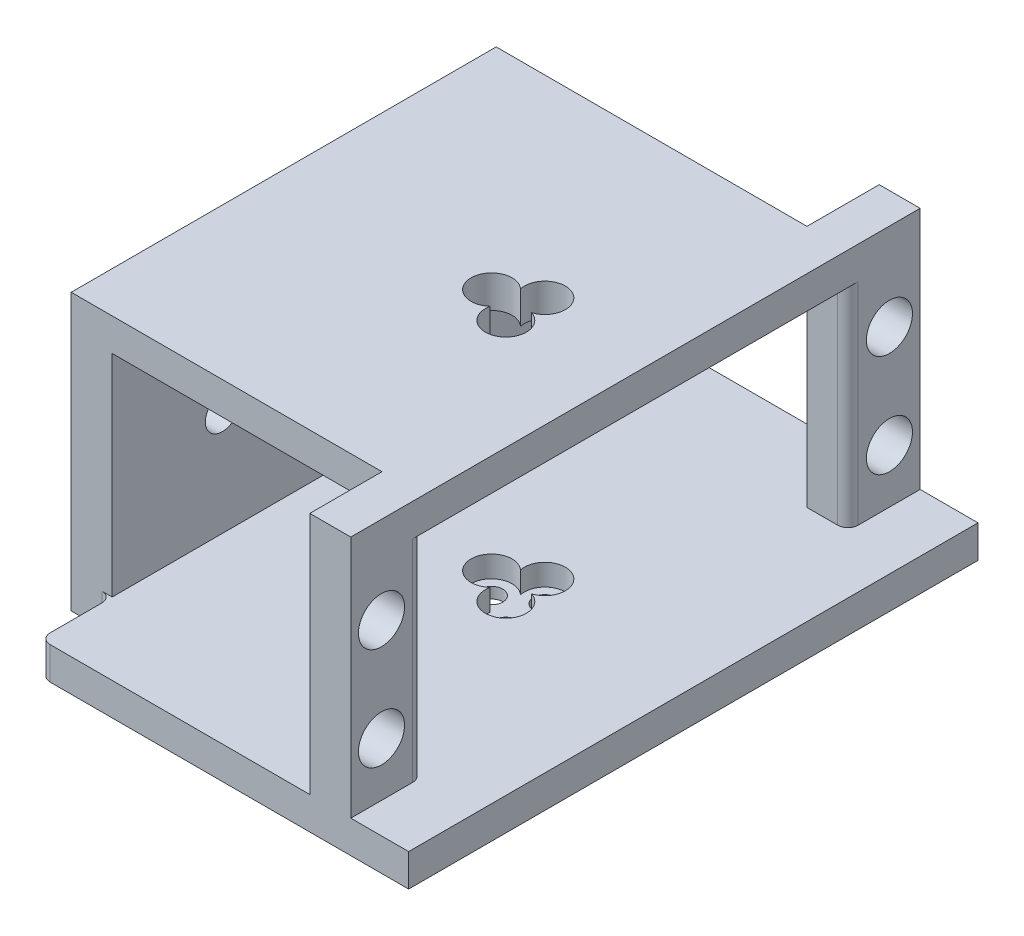
from build123d import *

# Parameters (mm, degrees)
SKETCH1_W           = 40
SKETCH1_H           = 55.6
BOSS_EXTRUDE1_DEPTH = 3.175
SKETCH2_W           = 4
SKETCH2_H           = 41.5
SKETCH2_H_2         = 7.05
BOSS_EXTRUDE2_DEPTH = 20.6
BOSS_EXTRUDE3_DEPTH = 3.175
SKETCH5_R           = 2.25
CUT_EXTRUDE2_DEPTH  = 4
SKETCH6_R           = 1.65
CUT_EXTRUDE3_DEPTH  = 4
FILLET1_R           = 1
SKETCH7_W           = 4
SKETCH7_H           = 7.05
CUT_EXTRUDE4_DEPTH  = 3.175
FILLET2_R           = 1
SKETCH8_R           = 1.1
CUT_EXTRUDE6_DEPTH  = 3.175
CUT_EXTRUDE7_DEPTH  = 2.1
CUT_EXTRUDE8_START  = 23.775
CUT_EXTRUDE8_DEPTH  = 23.775


with BuildPart() as part:
    # Sketch1 → Boss-Extrude1 (new body)
    with BuildSketch(Plane(origin=(0, 0, 0), x_dir=(1, 0, 0), z_dir=(0, 1, 0))):
        Rectangle(SKETCH1_W, SKETCH1_H)
    extrude(amount=BOSS_EXTRUDE1_DEPTH)

    # Sketch2 → Boss-Extrude2 (add)
    with BuildSketch(Plane(origin=(0, 3.175, 0), x_dir=(1, 0, 0), z_dir=(0, 1, 0))):
        with Locations((-18, 0)):
            Rectangle(SKETCH2_W, SKETCH2_H)
        with Locations((12.35, 24.275)):
            Rectangle(SKETCH2_W, SKETCH2_H_2)
        with Locations((12.35, -24.275)):
            Rectangle(SKETCH2_W, SKETCH2_H_2)
    extrude(amount=BOSS_EXTRUDE2_DEPTH)

    # Sketch3 → Boss-Extrude3 (add)
    with BuildSketch(Plane(origin=(0, 23.775, 0), x_dir=(1, 0, 0), z_dir=(0, 1, 0))):
        Polygon((-20, 20.75), (10.35, 20.75), (10.35, 27.8), (14.35, 27.8), (14.35, -27.8), (10.35, -27.8), (10.35, -20.75), (-20, -20.75), align=None)
    extrude(amount=BOSS_EXTRUDE3_DEPTH)

    # Sketch5 → Cut-Extrude2 (cut)
    with BuildSketch(Plane(origin=(14.35, 0, 0), x_dir=(0, 0, -1), z_dir=(1, 0, 0))):
        with Locations((-24.8, 8.425)):
            Circle(SKETCH5_R)
        with Locations((-24.8, 18.425)):
            Circle(SKETCH5_R)
        with Locations((24.8, 18.425)):
            Circle(SKETCH5_R)
        with Locations((24.8, 8.425)):
            Circle(SKETCH5_R)
    extrude(amount=-CUT_EXTRUDE2_DEPTH, mode=Mode.SUBTRACT)

    # Sketch6 → Cut-Extrude3 (cut)
    with BuildSketch(Plane.ZY.offset(20)):
        with Locations((10, 13.43)):
            Circle(SKETCH6_R)
    extrude(amount=-CUT_EXTRUDE3_DEPTH, mode=Mode.SUBTRACT)

    # Fillet1
    fillet1_edges = [part.edges().sort_by_distance(p)[0] for p in [
        (14.35, 13.475, 20.75),
        (14.35, 13.475, -20.75),
    ]]
    fillet(fillet1_edges, radius=FILLET1_R)

    # Sketch7 → Cut-Extrude4 (cut)
    with BuildSketch(Plane(origin=(0, 3.175, 0), x_dir=(1, 0, 0), z_dir=(0, 1, 0))):
        with Locations((-18, -24.275)):
            Rectangle(SKETCH7_W, SKETCH7_H)
        with Locations((-18, 24.275)):
            Rectangle(SKETCH7_W, SKETCH7_H)
    extrude(amount=-CUT_EXTRUDE4_DEPTH, mode=Mode.SUBTRACT)

    # Fillet2
    fillet2_edges = [part.edges().sort_by_distance(p)[0] for p in [
        (-16, 1.5875, 20.75),
        (-16, 1.5875, 27.8),
        (-16, 1.5875, -27.8),
        (-16, 1.5875, -20.75),
    ]]
    fillet(fillet2_edges, radius=FILLET2_R)

    # Sketch8 → Cut-Extrude6 (cut)
    with BuildSketch(Plane.XZ):
        with Locations(Location((3.6, 1.905255888, 0), (0, 0, 270))):
            Circle(SKETCH8_R)
        with Locations(Location((3.6, -1.905255888, 0), (0, 0, 270))):
            Circle(SKETCH8_R)
        with Locations(Location((0.3, 0, 0), (0, 0, 270))):
            Circle(SKETCH8_R)
    extrude(amount=-CUT_EXTRUDE6_DEPTH, mode=Mode.SUBTRACT)

    # Sketch9 → Cut-Extrude7 (cut)
    with BuildSketch(Plane(origin=(0, 3.175, 0), x_dir=(1, 0, 0), z_dir=(0, 1, 0))):
        with BuildLine():
            ThreePointArc((1.645861873, -1.479410632), (4.6, -3.637306696), (4.208276253, 0))
            ThreePointArc((4.208276253, 0), (4.6, 3.637306696), (1.645861873, 1.479410632))
            ThreePointArc((1.645861873, 1.479410632), (-1.7, 0), (1.645861873, -1.479410632))
        make_face()
    extrude(amount=-CUT_EXTRUDE7_DEPTH, mode=Mode.SUBTRACT)

    # Sketch10 → Cut-Extrude8 (cut)
    with BuildSketch(Plane(origin=(0, 3.175, 0), x_dir=(1, 0, 0), z_dir=(0, 1, 0)).offset(CUT_EXTRUDE8_START)):
        with BuildLine():
            ThreePointArc((1.645861873, -1.479410632), (4.6, -3.637306696), (4.208276253, 0))
            ThreePointArc((4.208276253, 0), (4.6, 3.637306696), (1.645861873, 1.479410632))
            ThreePointArc((1.645861873, 1.479410632), (-1.7, 0), (1.645861873, -1.479410632))
        make_face()
    extrude(amount=-CUT_EXTRUDE8_DEPTH, mode=Mode.SUBTRACT)


solid = part.part
